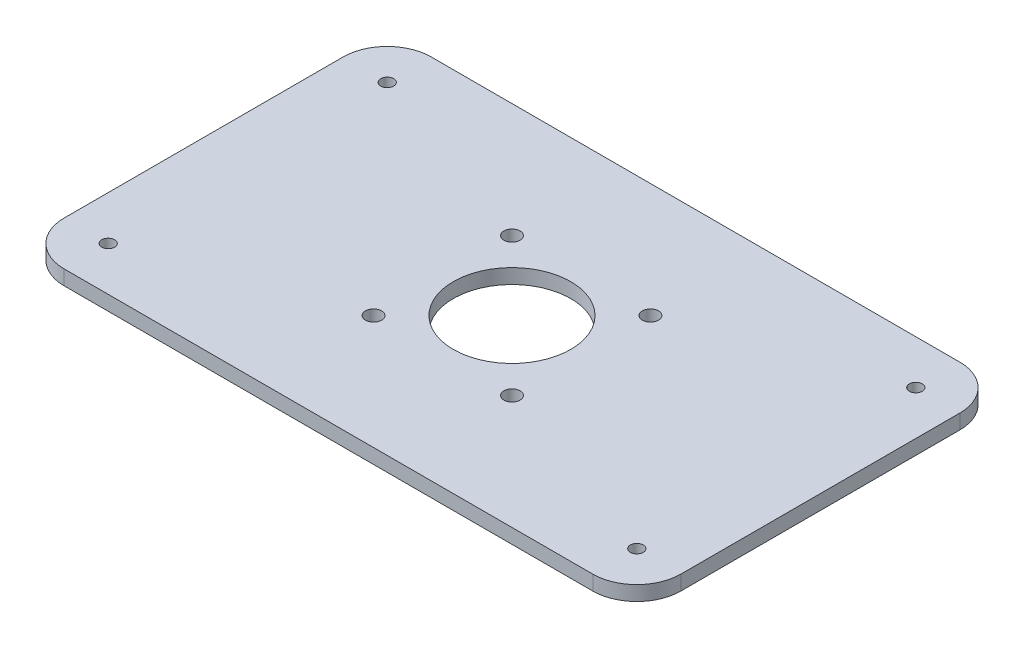
from build123d import *

# Parameters (mm, degrees)
SKETCH_1_R          = 60
SKETCH_1_R_2        = 20
EXTRUDE_1_DEPTH     = 5
SKETCH_4_W          = 210
SKETCH_4_H          = 125
SKETCH_4_R          = 60
EXTRUDE_2_DEPTH     = 5
SKETCH_5_R          = 2.2
CUT_EXTRUDE_2_DEPTH = 5
FILLET_1_R          = 15
SKETCH_2_R          = 2.75
CUT_EXTRUDE_3_DEPTH = 10


with BuildPart() as part:
    # 草图1 → 凸台-拉伸1 (new body)
    with BuildSketch(Plane(origin=(0, 0, 0), x_dir=(1, 0, 0), z_dir=(0, 1, 0))):
        with Locations(Location((0, 0, 0), (0, 0, 270))):
            Circle(SKETCH_1_R)
        with Locations(Location((0, 0, 0), (0, 0, 270))):
            Circle(SKETCH_1_R_2, mode=Mode.SUBTRACT)
    extrude(amount=EXTRUDE_1_DEPTH)

    # 草图4 → 凸台-拉伸2 (add)
    with BuildSketch(Plane(origin=(0, 0, 0), x_dir=(1, 0, 0), z_dir=(0, 1, 0))):
        Rectangle(SKETCH_4_W, SKETCH_4_H)
        Circle(SKETCH_4_R, mode=Mode.SUBTRACT)
    extrude(amount=EXTRUDE_2_DEPTH)

    # 草图5 → 切除-拉伸2 (cut)
    with BuildSketch(Plane(origin=(0, 5, 0), x_dir=(1, 0, 0), z_dir=(0, 1, 0))):
        with Locations(Location((-90, 47.5, 0), (0, 0, 270))):
            Circle(SKETCH_5_R)
        with Locations(Location((90, 47.5, 0), (0, 0, 90))):
            Circle(SKETCH_5_R)
        with Locations(Location((90, -47.5, 0), (0, 0, 270))):
            Circle(SKETCH_5_R)
        with Locations(Location((-90, -47.5, 0), (0, 0, 90))):
            Circle(SKETCH_5_R)
    extrude(amount=-CUT_EXTRUDE_2_DEPTH, mode=Mode.SUBTRACT)

    # 圆角1
    fillet_1_edges = [part.edges().sort_by_distance(p)[0] for p in [
        (-105, 2.5, -62.5),
        (-105, 2.5, 62.5),
        (105, 2.5, 62.5),
        (105, 2.5, -62.5),
    ]]
    fillet(fillet_1_edges, radius=FILLET_1_R)

    # 草图2 → 切除-拉伸3 (cut)
    with BuildSketch(Plane(origin=(0, 5, 0), x_dir=(1, 0, 0), z_dir=(0, 1, 0))):
        with Locations(Location((-23.57, 23.57, 0), (0, 0, 270))):
            Circle(SKETCH_2_R)
        with Locations(Location((23.57, 23.57, 0), (0, 0, 270))):
            Circle(SKETCH_2_R)
        with Locations(Location((23.57, -23.57, 0), (0, 0, 270))):
            Circle(SKETCH_2_R)
        with Locations(Location((-23.57, -23.57, 0), (0, 0, 270))):
            Circle(SKETCH_2_R)
    extrude(amount=-CUT_EXTRUDE_3_DEPTH, mode=Mode.SUBTRACT)


solid = part.part
